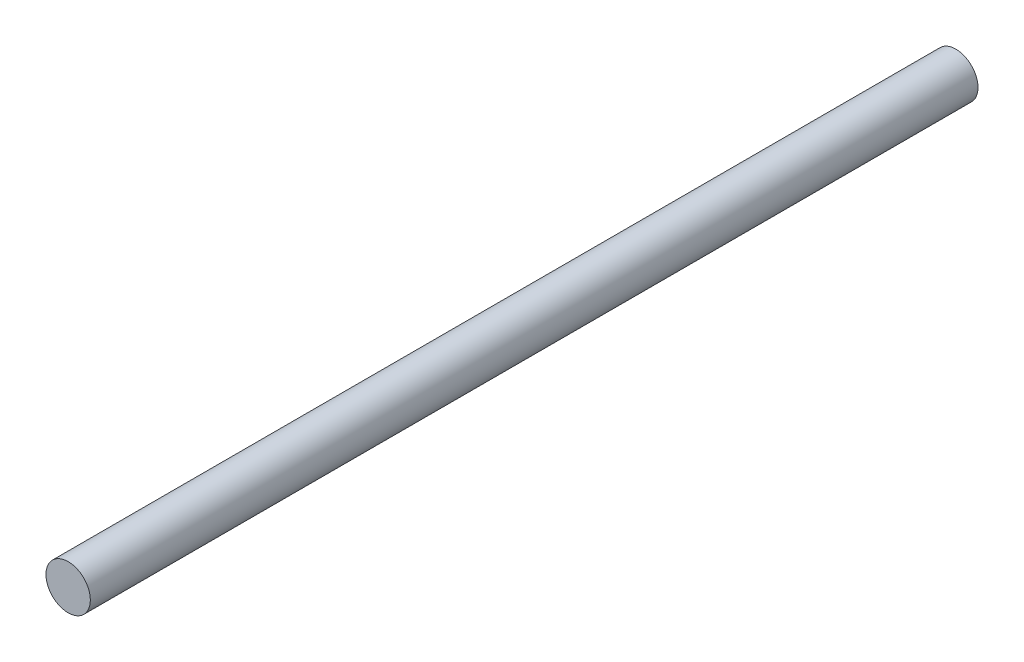
from build123d import *

# Parameters (mm, degrees)
ESQUISSE1_R        = 50
BOSS_EXTRU_1_DEPTH = 2000


with BuildPart() as part:
    # Esquisse1 → Boss.-Extru.1 (new body)
    with BuildSketch(Plane.XY):
        Circle(ESQUISSE1_R)
    extrude(amount=BOSS_EXTRU_1_DEPTH)


solid = part.part
